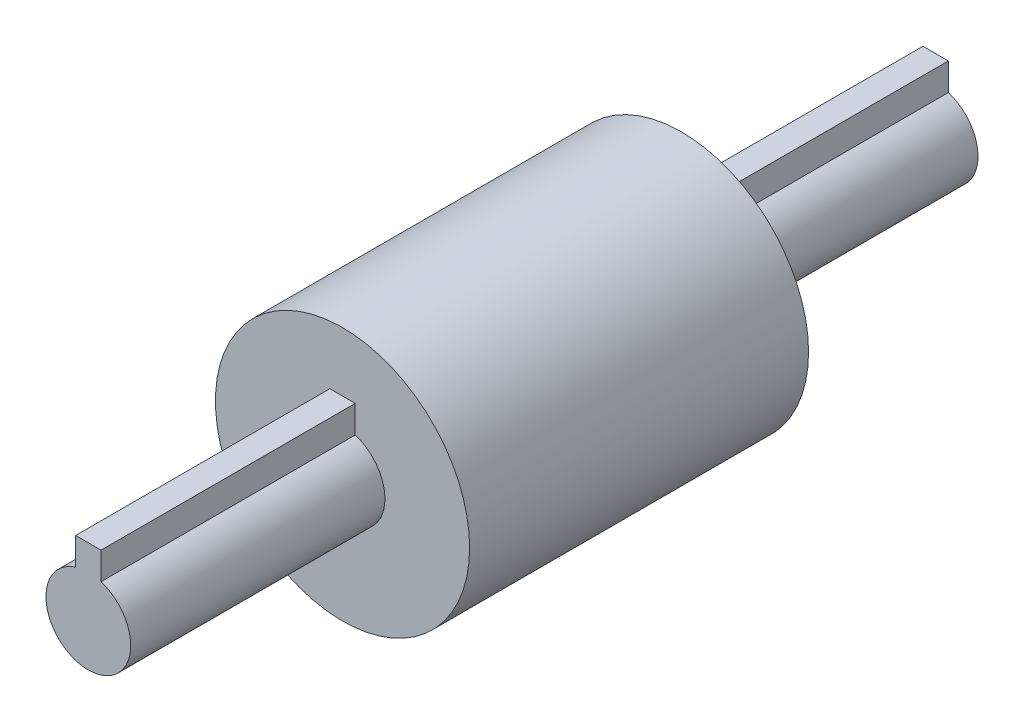
from build123d import *

# Parameters (mm, degrees)
EXTRUDE_1_DEPTH = 30
SKETCH_2_R      = 15
EXTRUDE_2_DEPTH = 25
EXTRUDE_3_DEPTH = 30
SKETCH_4_R      = 15
EXTRUDE_4_DEPTH = 15
EXTRUDE_5_DEPTH = 15


with BuildPart() as part:
    # 草图1 → 凸台-拉伸1 (new body)
    with BuildSketch(Plane.XY):
        with BuildLine():
            Line((-1.5, 8), (-1.5, 4.769696007))
            ThreePointArc((-1.5, 4.769696007), (0, 5), (1.5, 4.769696007))
            Line((1.5, 4.769696007), (1.5, 8))
            Line((1.5, 8), (-1.5, 8))
        make_face()
        with BuildLine():
            Line((1.5, 0), (0, 0))
            Line((0, 0), (-1.5, 0))
            Line((-1.5, 0), (-1.5, 4.769696007))
            ThreePointArc((-1.5, 4.769696007), (-2.958039892, -4.031128874), (5, 0))
            ThreePointArc((5, 0), (4.031128874, 2.958039892), (1.5, 4.769696007))
            Line((1.5, 4.769696007), (1.5, 0))
        make_face()
        with BuildLine():
            Line((-1.5, 0), (0, 0))
            Line((0, 0), (1.5, 0))
            Line((1.5, 0), (1.5, 4.769696007))
            ThreePointArc((1.5, 4.769696007), (0, 5), (-1.5, 4.769696007))
            Line((-1.5, 4.769696007), (-1.5, 0))
        make_face()
    extrude(amount=EXTRUDE_1_DEPTH)

    # 草图2 → 凸台-拉伸2 (add)
    with BuildSketch(Plane.XY.offset(30)):
        Circle(SKETCH_2_R)
    extrude(amount=EXTRUDE_2_DEPTH)

    # 草图3 → 凸台-拉伸3 (add)
    with BuildSketch(Plane.XY.offset(55)):
        with BuildLine():
            Line((1.5, 0), (0, 0))
            Line((0, 0), (-1.5, 0))
            Line((-1.5, 0), (-1.5, 4.769696007))
            ThreePointArc((-1.5, 4.769696007), (-2.958039892, -4.031128874), (5, 0))
            ThreePointArc((5, 0), (4.031128874, 2.958039892), (1.5, 4.769696007))
            Line((1.5, 4.769696007), (1.5, 0))
        make_face()
        with BuildLine():
            Line((-1.5, 0), (0, 0))
            Line((0, 0), (1.5, 0))
            Line((1.5, 0), (1.5, 4.769696007))
            ThreePointArc((1.5, 4.769696007), (0, 5), (-1.5, 4.769696007))
            Line((-1.5, 4.769696007), (-1.5, 0))
        make_face()
        with BuildLine():
            Line((-1.5, 8), (-1.5, 4.769696007))
            ThreePointArc((-1.5, 4.769696007), (0, 5), (1.5, 4.769696007))
            Line((1.5, 4.769696007), (1.5, 8))
            Line((1.5, 8), (-1.5, 8))
        make_face()
    extrude(amount=EXTRUDE_3_DEPTH)

    # 草图4 → 凸台-拉伸4 (add)
    with BuildSketch(Plane.XY.offset(55)):
        Circle(SKETCH_4_R)
    extrude(amount=EXTRUDE_4_DEPTH)

    # 草图5 → 凸台-拉伸5 (add)
    with BuildSketch(Plane.XY.offset(85)):
        with BuildLine():
            ThreePointArc((1.5, 4.769696007), (0, 5), (-1.5, 4.769696007))
            ThreePointArc((-1.5, 4.769696007), (-2.958039892, -4.031128874), (5, 0))
            ThreePointArc((5, 0), (4.031128874, 2.958039892), (1.5, 4.769696007))
        make_face()
        with BuildLine():
            Line((1.5, 8), (-1.5, 8))
            Line((-1.5, 8), (-1.5, 4.769696007))
            ThreePointArc((-1.5, 4.769696007), (0, 5), (1.5, 4.769696007))
            Line((1.5, 4.769696007), (1.5, 8))
        make_face()
    extrude(amount=EXTRUDE_5_DEPTH)


solid = part.part
